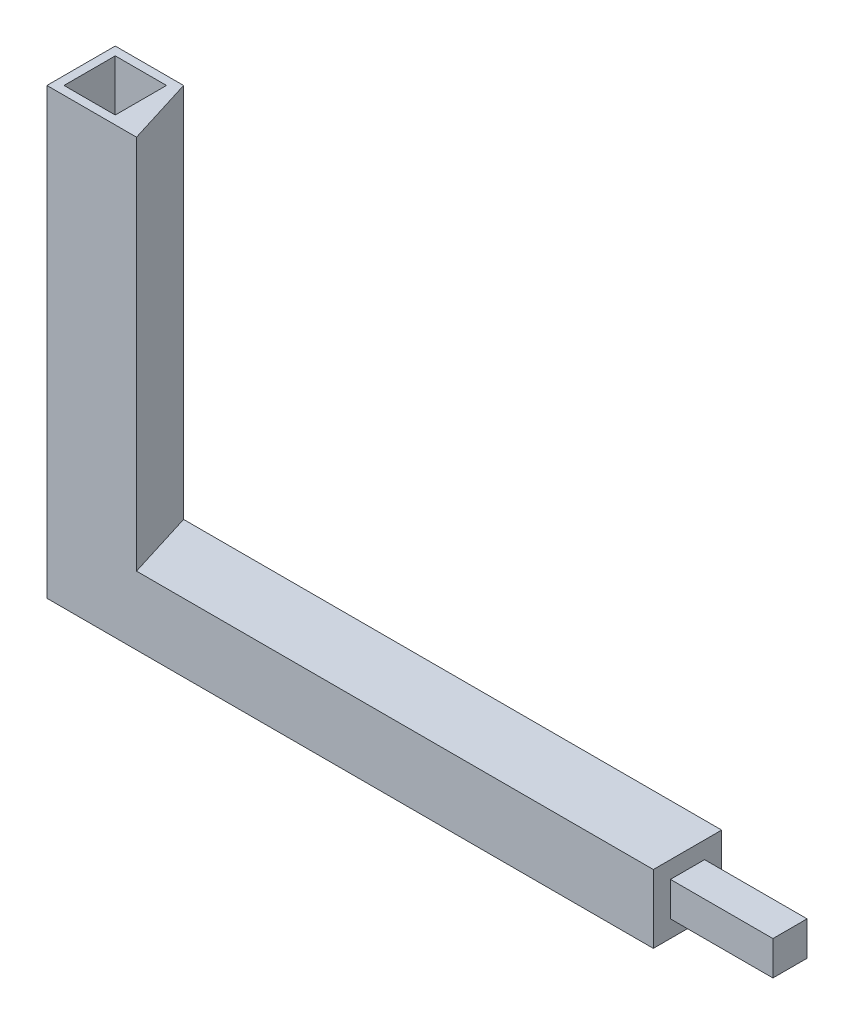
from build123d import *

# Parameters (mm, degrees)
ESQUISSE2_W             = 177.5
ESQUISSE2_H             = 20
BOSS_EXTRU_1_DEPTH      = 20
BOSS_EXTRU_3_DEPTH      = 110
ESQUISSE5_W             = 10
ESQUISSE5_H             = 10
BOSS_EXTRU_4_DEPTH      = 30
D_GAGEMENT_M31_D        = 3.2
D_GAGEMENT_M31_DEPTH    = 10
D_GAGEMENT_M31_TIP      = 0.96137699
ESQUISSE8_W             = 15
ESQUISSE8_H             = 15
ENL_V_MAT_EXTRU_1_DEPTH = 60


with BuildPart() as part:
    # Esquisse2 → Boss.-Extru.1 (new body)
    with BuildSketch(Plane(origin=(0, 0, 0), x_dir=(1, 0, 0), z_dir=(0, 1, 0))):
        with Locations((88.75, 10)):
            Rectangle(ESQUISSE2_W, ESQUISSE2_H)
    extrude(amount=BOSS_EXTRU_1_DEPTH)

    # Esquisse4 → Boss.-Extru.3 (add)
    with BuildSketch(Plane(origin=(0, 20, 0), x_dir=(1, 0, 0), z_dir=(0, 1, 0))):
        Polygon((0, 20), (20, 20), (26.229306319, 0), (0, 0), align=None)
    extrude(amount=BOSS_EXTRU_3_DEPTH)

    # Esquisse5 → Boss.-Extru.4 (add)
    with BuildSketch(Plane(origin=(177.5, 0, 0), x_dir=(0, 0, -1), z_dir=(1, 0, 0))):
        with Locations((10, 10)):
            Rectangle(ESQUISSE5_W, ESQUISSE5_H)
    extrude(amount=BOSS_EXTRU_4_DEPTH)

    # Dégagement M31
    with Locations(Plane(origin=(10, 80, -20), x_dir=(-1, 0, 0), z_dir=(0, 0, -1))):
        with Locations((0, 0)):
            Hole(D_GAGEMENT_M31_D / 2, depth=D_GAGEMENT_M31_DEPTH)
            with Locations((0, 0, -(D_GAGEMENT_M31_DEPTH + D_GAGEMENT_M31_TIP / 2))):  # 118° drill point
                Cone(0, D_GAGEMENT_M31_D / 2, D_GAGEMENT_M31_TIP, mode=Mode.SUBTRACT)

    # Esquisse8 → Enlèv. mat.-Extru.1 (cut)
    with BuildSketch(Plane(origin=(0, 130, 0), x_dir=(1, 0, 0), z_dir=(0, 1, 0))):
        with Locations((10, 10)):
            Rectangle(ESQUISSE8_W, ESQUISSE8_H)
    extrude(amount=-ENL_V_MAT_EXTRU_1_DEPTH, mode=Mode.SUBTRACT)


solid = part.part
